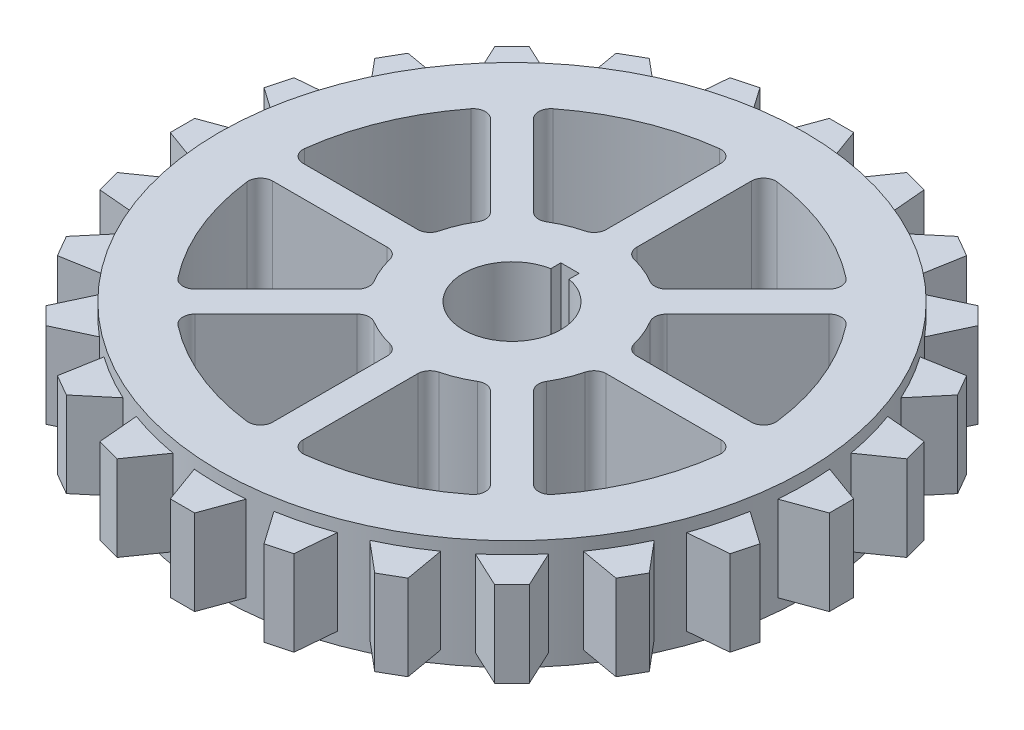
from build123d import *

# Parameters (mm, degrees)
SKETCH1_R               = 48
BOSS_EXTRUDE1_DEPTH     = 18
CUT_EXTRUDE1_DEPTH      = 70.978568148
CUT_EXTRUDE1_DEPTH_BACK = 70.978568148
SKETCH5_R               = 41.5
CUT_EXTRUDE2_DEPTH      = 1
BOSS_EXTRUDE2_DEPTH     = 14
CIRPATTERN1_COUNT       = 24


with BuildPart() as part:
    # Sketch1 → Boss-Extrude1 (new body)
    with BuildSketch(Plane(origin=(0, 0, 0), x_dir=(1, 0, 0), z_dir=(0, 1, 0))):
        with Locations(Location((0, 0, 0), (0, 0, 270))):
            Circle(SKETCH1_R)
        with BuildLine():
            Line((-1.5, 7.858116823), (-1.5, 9.506597025))
            Line((-1.5, 9.506597025), (1.5, 9.506597025))
            Line((1.5, 9.506597025), (1.5, 7.858116823))
            ThreePointArc((1.5, 7.858116823), (0, -8), (-1.5, 7.858116823))
        make_face(mode=Mode.SUBTRACT)
    extrude(amount=BOSS_EXTRUDE1_DEPTH)

    # Sketch2 → Cut-Extrude1 (cut, two sides: drawn at the far end of the back side and taken through both)
    with BuildSketch(Plane(origin=(0, 17, 0), x_dir=(1, 0, 0), z_dir=(0, 1, 0)).offset(-CUT_EXTRUDE1_DEPTH_BACK)):
        with BuildLine():
            ThreePointArc((-36.725331857, -2.5), (-38.223077911, -3.174572991), (-38.71048493, -4.743243243))
            ThreePointArc((-38.71048493, -4.743243243), (-36.031301768, -14.924653862), (-30.726425859, -24.018466935))
            ThreePointArc((-30.726425859, -24.018466935), (-29.272559678, -24.7830355), (-27.73649815, -24.200964244))
            Line((-27.73649815, -24.200964244), (-14.456344493, -10.920810587))
            ThreePointArc((-14.456344493, -10.920810587), (-13.885632203, -9.751687534), (-14.15482205, -8.478856806))
            ThreePointArc((-14.15482205, -8.478856806), (-15.244012286, -6.314276634), (-16.004427802, -4.013513514))
            ThreePointArc((-16.004427802, -4.013513514), (-16.714109074, -2.923140309), (-17.944358445, -2.5))
            Line((-17.944358445, -2.5), (-36.725331857, -2.5))
        make_face()
        with BuildLine():
            ThreePointArc((-8.478856806, -14.15482205), (-6.314276634, -15.244012286), (-4.013513514, -16.004427802))
            ThreePointArc((-4.013513514, -16.004427802), (-2.923140309, -16.714109074), (-2.5, -17.944358445))
            Line((-2.5, -17.944358445), (-2.5, -36.725331857))
            ThreePointArc((-2.5, -36.725331857), (-3.174572991, -38.223077911), (-4.743243243, -38.71048493))
            ThreePointArc((-4.743243243, -38.71048493), (-14.924653862, -36.031301768), (-24.018466935, -30.726425859))
            ThreePointArc((-24.018466935, -30.726425859), (-24.7830355, -29.272559678), (-24.200964244, -27.73649815))
            Line((-24.200964244, -27.73649815), (-10.920810587, -14.456344493))
            ThreePointArc((-10.920810587, -14.456344493), (-9.751687534, -13.885632203), (-8.478856806, -14.15482205))
        make_face()
        with BuildLine():
            ThreePointArc((4.013513514, -16.004427802), (6.314276634, -15.244012286), (8.478856806, -14.15482205))
            ThreePointArc((8.478856806, -14.15482205), (9.751687534, -13.885632203), (10.920810587, -14.456344493))
            Line((10.920810587, -14.456344493), (24.200964244, -27.73649815))
            ThreePointArc((24.200964244, -27.73649815), (24.7830355, -29.272559678), (24.018466935, -30.726425859))
            ThreePointArc((24.018466935, -30.726425859), (14.924653862, -36.031301768), (4.743243243, -38.71048493))
            ThreePointArc((4.743243243, -38.71048493), (3.174572991, -38.223077911), (2.5, -36.725331857))
            Line((2.5, -36.725331857), (2.5, -17.944358445))
            ThreePointArc((2.5, -17.944358445), (2.923140309, -16.714109074), (4.013513514, -16.004427802))
        make_face()
        with BuildLine():
            ThreePointArc((16.004427802, 4.013513514), (15.244012286, 6.314276634), (14.15482205, 8.478856806))
            ThreePointArc((14.15482205, 8.478856806), (13.885632203, 9.751687534), (14.456344493, 10.920810587))
            Line((14.456344493, 10.920810587), (27.73649815, 24.200964244))
            ThreePointArc((27.73649815, 24.200964244), (29.272559678, 24.7830355), (30.726425859, 24.018466935))
            ThreePointArc((30.726425859, 24.018466935), (36.031301768, 14.924653862), (38.71048493, 4.743243243))
            ThreePointArc((38.71048493, 4.743243243), (38.223077911, 3.174572991), (36.725331857, 2.5))
            Line((36.725331857, 2.5), (17.944358445, 2.5))
            ThreePointArc((17.944358445, 2.5), (16.714109074, 2.923140309), (16.004427802, 4.013513514))
        make_face()
        with BuildLine():
            ThreePointArc((8.478856806, 14.15482205), (6.314276634, 15.244012286), (4.013513514, 16.004427802))
            ThreePointArc((4.013513514, 16.004427802), (2.923140309, 16.714109074), (2.5, 17.944358445))
            Line((2.5, 17.944358445), (2.5, 36.725331857))
            ThreePointArc((2.5, 36.725331857), (3.174572991, 38.223077911), (4.743243243, 38.71048493))
            ThreePointArc((4.743243243, 38.71048493), (14.924653862, 36.031301768), (24.018466935, 30.726425859))
            ThreePointArc((24.018466935, 30.726425859), (24.7830355, 29.272559678), (24.200964244, 27.73649815))
            Line((24.200964244, 27.73649815), (10.920810587, 14.456344493))
            ThreePointArc((10.920810587, 14.456344493), (9.751687534, 13.885632203), (8.478856806, 14.15482205))
        make_face()
        with BuildLine():
            ThreePointArc((-8.478856806, 14.15482205), (-9.751687534, 13.885632203), (-10.920810587, 14.456344493))
            Line((-10.920810587, 14.456344493), (-24.200964244, 27.73649815))
            ThreePointArc((-24.200964244, 27.73649815), (-24.7830355, 29.272559678), (-24.018466935, 30.726425859))
            ThreePointArc((-24.018466935, 30.726425859), (-14.924653862, 36.031301768), (-4.743243243, 38.71048493))
            ThreePointArc((-4.743243243, 38.71048493), (-3.174572991, 38.223077911), (-2.5, 36.725331857))
            Line((-2.5, 36.725331857), (-2.5, 17.944358445))
            ThreePointArc((-2.5, 17.944358445), (-2.923140309, 16.714109074), (-4.013513514, 16.004427802))
            ThreePointArc((-4.013513514, 16.004427802), (-6.314276634, 15.244012286), (-8.478856806, 14.15482205))
        make_face()
        with BuildLine():
            ThreePointArc((-14.15482205, 8.478856806), (-15.244012286, 6.314276634), (-16.004427802, 4.013513514))
            ThreePointArc((-16.004427802, 4.013513514), (-16.714109074, 2.923140309), (-17.944358445, 2.5))
            Line((-17.944358445, 2.5), (-36.725331857, 2.5))
            ThreePointArc((-36.725331857, 2.5), (-38.223077911, 3.174572991), (-38.71048493, 4.743243243))
            ThreePointArc((-38.71048493, 4.743243243), (-36.031301768, 14.924653862), (-30.726425859, 24.018466935))
            ThreePointArc((-30.726425859, 24.018466935), (-29.272559678, 24.7830355), (-27.73649815, 24.200964244))
            Line((-27.73649815, 24.200964244), (-14.456344493, 10.920810587))
            ThreePointArc((-14.456344493, 10.920810587), (-13.885632203, 9.751687534), (-14.15482205, 8.478856806))
        make_face()
        with BuildLine():
            Line((17.944358445, -2.5), (36.725331857, -2.5))
            ThreePointArc((36.725331857, -2.5), (38.223077911, -3.174572991), (38.71048493, -4.743243243))
            ThreePointArc((38.71048493, -4.743243243), (36.031301768, -14.924653862), (30.726425859, -24.018466935))
            ThreePointArc((30.726425859, -24.018466935), (29.272559678, -24.7830355), (27.73649815, -24.200964244))
            Line((27.73649815, -24.200964244), (14.456344493, -10.920810587))
            ThreePointArc((14.456344493, -10.920810587), (13.885632203, -9.751687534), (14.15482205, -8.478856806))
            ThreePointArc((14.15482205, -8.478856806), (15.244012286, -6.314276634), (16.004427802, -4.013513514))
            ThreePointArc((16.004427802, -4.013513514), (16.714109074, -2.923140309), (17.944358445, -2.5))
        make_face()
    extrude(amount=CUT_EXTRUDE1_DEPTH + CUT_EXTRUDE1_DEPTH_BACK, mode=Mode.SUBTRACT)

    # Sketch5 → Cut-Extrude2 (cut)
    with BuildSketch(Plane.XZ):
        with Locations(Location((0, 0, 0), (0, 0, 270))):
            Circle(SKETCH5_R)
    extrude(amount=-CUT_EXTRUDE2_DEPTH, mode=Mode.SUBTRACT)

    # Sketch8 → Boss-Extrude2 (add)
    with BuildSketch(Plane(origin=(0, 2, 0), x_dir=(-1, 0, 0), z_dir=(0, -1, 0))):
        with BuildLine():
            Line((-2, 54), (2, 54))
            Line((2, 54), (4.252519055, 47.81125476))
            ThreePointArc((4.252519055, 47.81125476), (0, 48), (-4.252519055, 47.81125476))
            Line((-4.252519055, 47.81125476), (-2, 54))
        make_face()
    boss_extrude2 = extrude(amount=-BOSS_EXTRUDE2_DEPTH)

    # CirPattern1: Boss-Extrude2 ×24 about axis
    cirpattern1_axis = Axis((0, 0, 0), (0, 1, 0))
    for i in range(1, CIRPATTERN1_COUNT):
        add(boss_extrude2.rotate(cirpattern1_axis, i * 360 / CIRPATTERN1_COUNT))


solid = part.part
